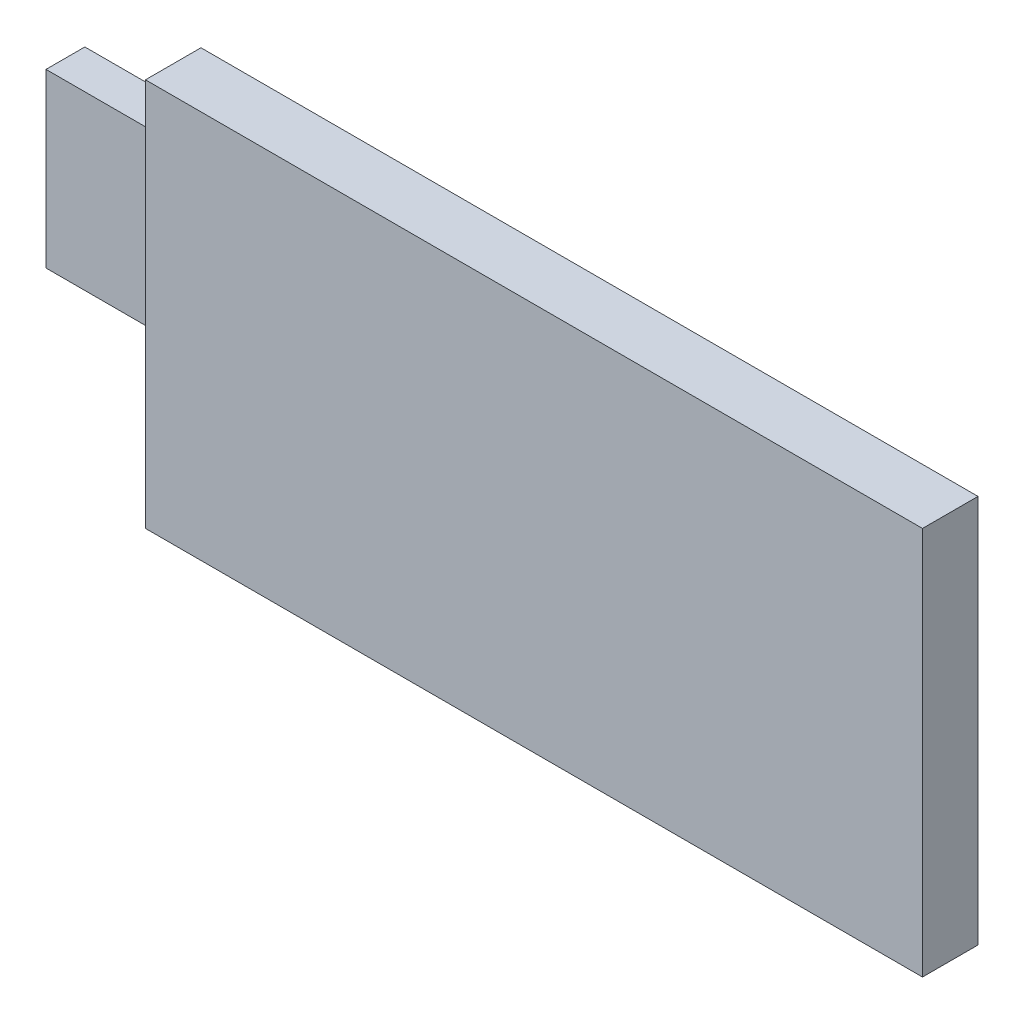
from build123d import *

# Parameters (mm, degrees)
SKETCH1_W           = 35.56
SKETCH1_H           = 17.78
BOSS_EXTRUDE1_DEPTH = 2.54
SKETCH2_W           = 5.842
SKETCH2_H           = 7.874
BOSS_EXTRUDE2_DEPTH = 1.778


with BuildPart() as part:
    # Sketch1 → Boss-Extrude1 (new body)
    with BuildSketch(Plane.XY):
        Rectangle(SKETCH1_W, SKETCH1_H)
    extrude(amount=BOSS_EXTRUDE1_DEPTH)

    # Sketch2 → Boss-Extrude2 (add)
    with BuildSketch(Plane.XY):
        with Locations((-20.172155885, 2.328602081)):
            Rectangle(SKETCH2_W, SKETCH2_H)
    extrude(amount=BOSS_EXTRUDE2_DEPTH)


solid = part.part
